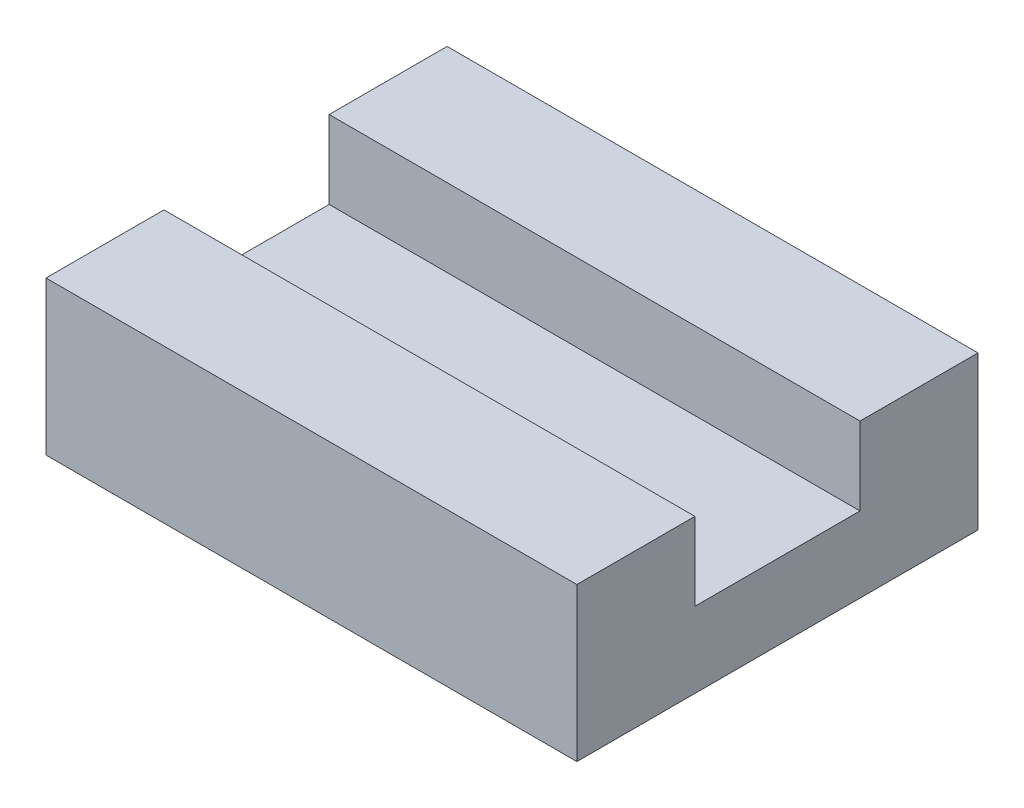
from build123d import *

# Parameters (mm, degrees)
EXTRUDE_1_DEPTH = 22.5


with BuildPart() as part:
    # 草图1 → 凸台-拉伸1 (new body)
    with BuildSketch(Plane(origin=(-11.25, 0, 0), x_dir=(0, -1, 0), z_dir=(-1, 0, 0))):
        Polygon((-6.5, 3.5), (-3.2, 3.5), (-3.2, -3.5), (-6.5, -3.5), (-6.5, -8.5), (0, -8.5), (0, 8.5), (-6.5, 8.5), align=None)
    extrude(amount=-EXTRUDE_1_DEPTH)


solid = part.part
